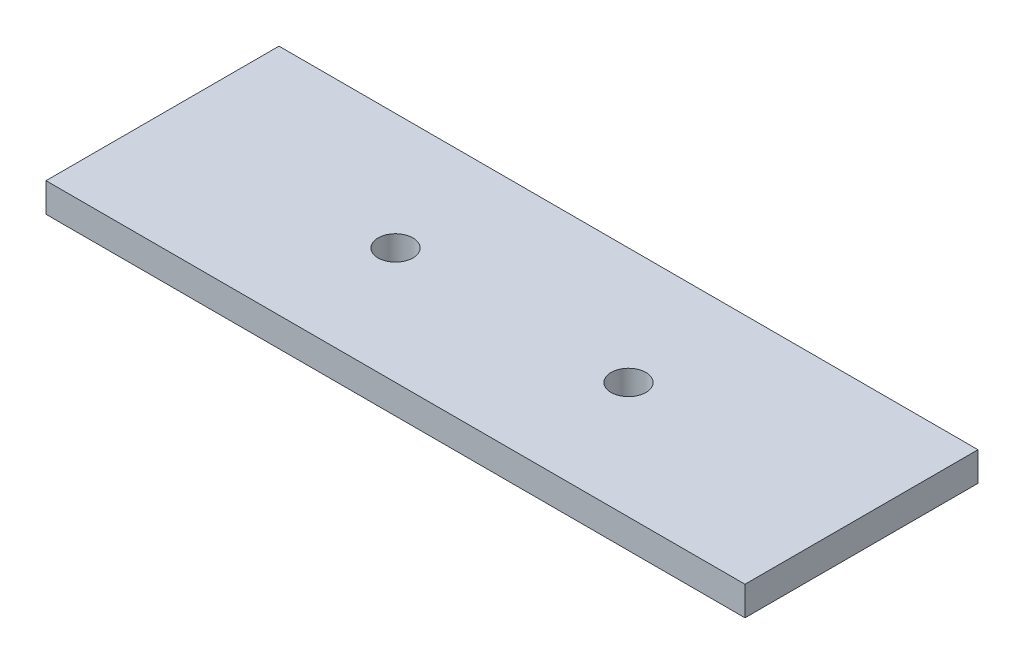
from build123d import *

# Parameters (mm, degrees)
SKETCH1_W             = 76.2
SKETCH1_H             = 25.4
BOSS_EXTRUDE1_DEPTH   = 3.175
F_6_CLEARANCE_HOLE1_D = 3.7973


with BuildPart() as part:
    # Sketch1 → Boss-Extrude1 (new body)
    with BuildSketch(Plane(origin=(0, 0, 0), x_dir=(1, 0, 0), z_dir=(0, 1, 0))):
        Rectangle(SKETCH1_W, SKETCH1_H)
    extrude(amount=BOSS_EXTRUDE1_DEPTH)

    # #6 Clearance Hole1 (through all)
    with Locations(Plane(origin=(0, 3.175, 0), x_dir=(1, 0, 0), z_dir=(0, 1, 0))):
        with Locations((-12.7, 0), (12.7, 0)):
            Hole(F_6_CLEARANCE_HOLE1_D / 2)


solid = part.part
